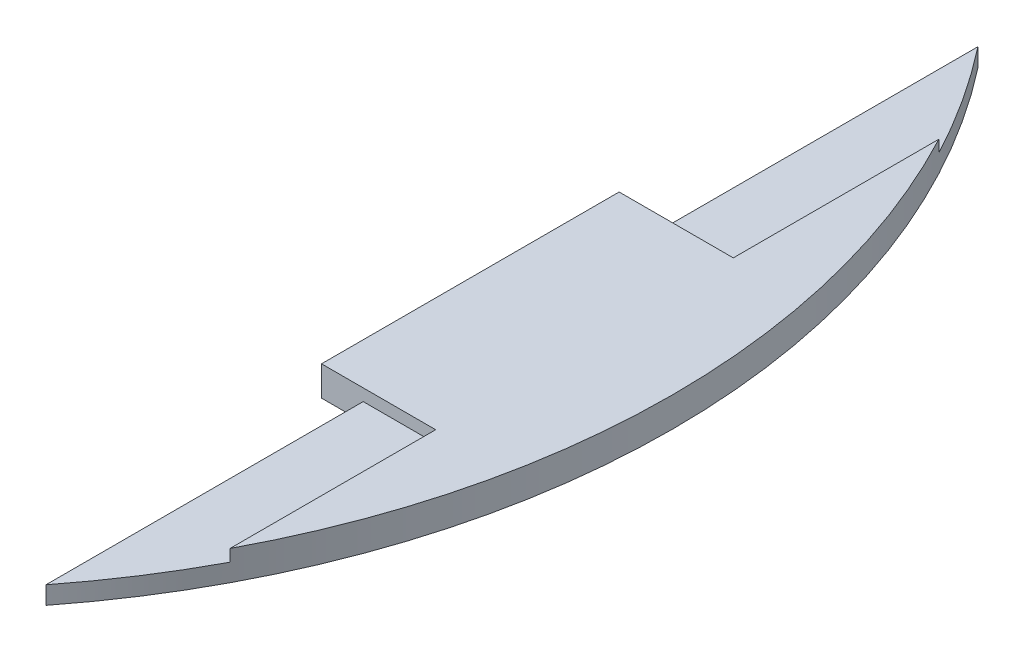
from build123d import *

# Parameters (mm, degrees)
BOSS_EXTRUDE1_DEPTH = 2.5
SKETCH2_W           = 6.089
SKETCH2_H           = 29.817230859
CUT_EXTRUDE1_DEPTH  = 1


with BuildPart() as part:
    # Sketch1 → Boss-Extrude1 (new body)
    with BuildSketch(Plane(origin=(0, 0, 0), x_dir=(1, 0, 0), z_dir=(0, 1, 0))):
        with BuildLine():
            Line((50, -12.5), (50, -39.143965052))
            ThreePointArc((50, -39.143965052), (63.5, 0), (50, 39.143965052))
            Line((50, 39.143965052), (50, 12.5))
            Line((50, 12.5), (46.5, 12.5))
            Line((46.5, 12.5), (46.5, -12.5))
            Line((46.5, -12.5), (50, -12.5))
        make_face()
    extrude(amount=BOSS_EXTRUDE1_DEPTH)

    # Sketch2 → Cut-Extrude1 (cut)
    with BuildSketch(Plane(origin=(0, 2.5, 0), x_dir=(1, 0, 0), z_dir=(0, 1, 0))):
        with Locations((53.0445, 27.40861543)):
            Rectangle(SKETCH2_W, SKETCH2_H)
        with Locations((53.0445, -27.40861543)):
            Rectangle(SKETCH2_W, SKETCH2_H)
    extrude(amount=-CUT_EXTRUDE1_DEPTH, mode=Mode.SUBTRACT)


solid = part.part
